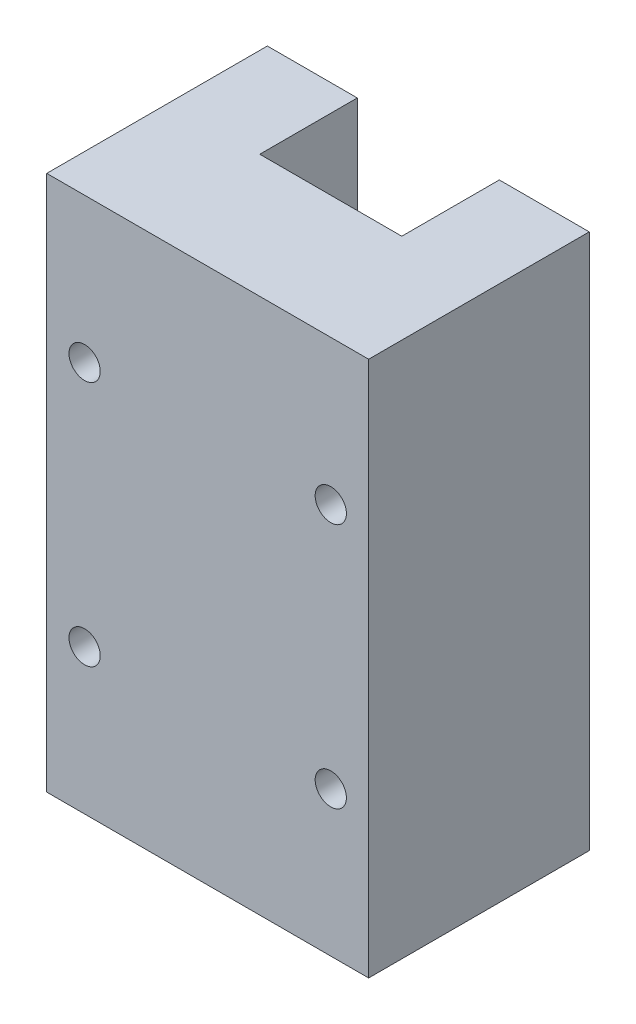
from build123d import *

# Parameters (mm, degrees)
SKETCH_1_W          = 34
SKETCH_1_H          = 23.3
EXTRUDE_1_DEPTH     = 28.3
SKETCH_2_W          = 15
SKETCH_2_H          = 10.3
CUT_EXTRUDE_1_DEPTH = 64.525191853
M4X0_7_1_D          = 3.3
M4X0_7_1_DEPTH      = 10.1
M4X0_7_1_TIP        = 0.991420021


with BuildPart() as part:
    # 草图1 → 凸台-拉伸1 (new, symmetric)
    with BuildSketch(Plane(origin=(0, 0, 0), x_dir=(1, 0, 0), z_dir=(0, 1, 0))):
        with Locations((0, 11.65)):
            Rectangle(SKETCH_1_W, SKETCH_1_H)
    extrude(amount=EXTRUDE_1_DEPTH, both=True)

    # 草图2 → 切除-拉伸1 (cut, through all)
    with BuildSketch(Plane(origin=(0, 28.3, 0), x_dir=(1, 0, 0), z_dir=(0, 1, 0))):
        with Locations((0, 18.15)):
            Rectangle(SKETCH_2_W, SKETCH_2_H)
    extrude(amount=-CUT_EXTRUDE_1_DEPTH, mode=Mode.SUBTRACT)

    # M4x0.7 螺纹孔1
    with Locations(Plane.XY):
        with Locations((-13, 13), (-13, -13), (13, -13), (13, 13)):
            Hole(M4X0_7_1_D / 2, depth=M4X0_7_1_DEPTH)
            with Locations((0, 0, -(M4X0_7_1_DEPTH + M4X0_7_1_TIP / 2))):  # 118° drill point
                Cone(0, M4X0_7_1_D / 2, M4X0_7_1_TIP, mode=Mode.SUBTRACT)


solid = part.part
